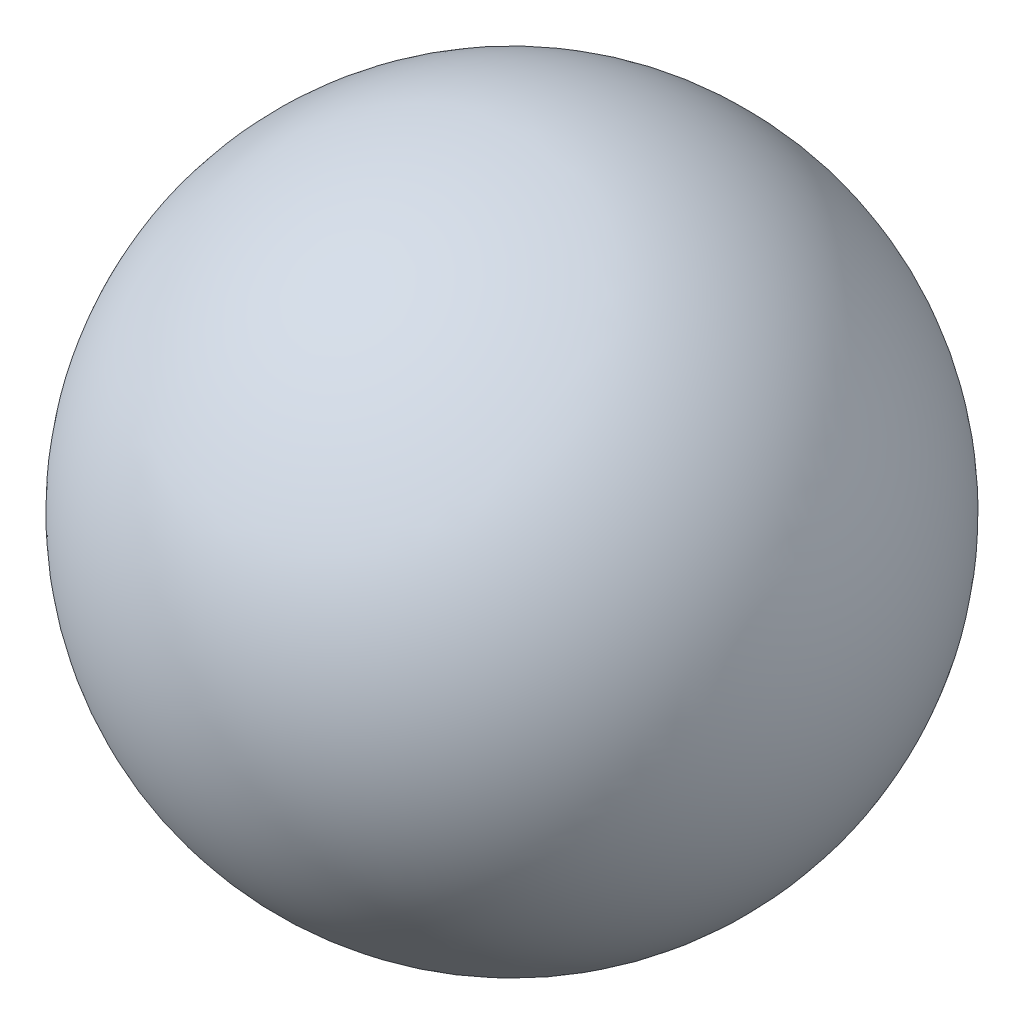
from build123d import *


with BuildPart() as part:
    # Sketch1 → Revolve1 (revolve)
    with BuildSketch(Plane.XY):
        with BuildLine():
            Line((-25.4, 0), (25.4, 0))
            ThreePointArc((25.4, 0), (0, 25.4), (-25.4, 0))
        make_face()
    revolve(axis=Axis((-25.4, 0, 0), (1, 0, 0)))


solid = part.part
